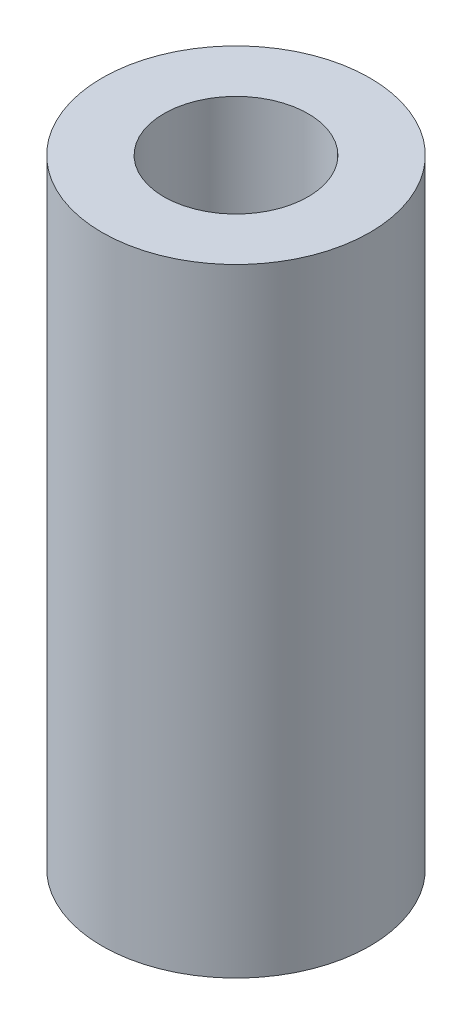
from build123d import *

# Parameters (mm, degrees)
SKETCH1_R           = 3.25
SKETCH1_R_2         = 1.75
BOSS_EXTRUDE1_DEPTH = 15


with BuildPart() as part:
    # Sketch1 → Boss-Extrude1 (new body)
    with BuildSketch(Plane(origin=(0, 0, 0), x_dir=(1, 0, 0), z_dir=(0, 1, 0))):
        with Locations(Location((0, 0, 0), (0, 0, 270))):
            Circle(SKETCH1_R)
        with Locations(Location((0, 0, 0), (0, 0, 270))):
            Circle(SKETCH1_R_2, mode=Mode.SUBTRACT)
    extrude(amount=BOSS_EXTRUDE1_DEPTH)


solid = part.part
